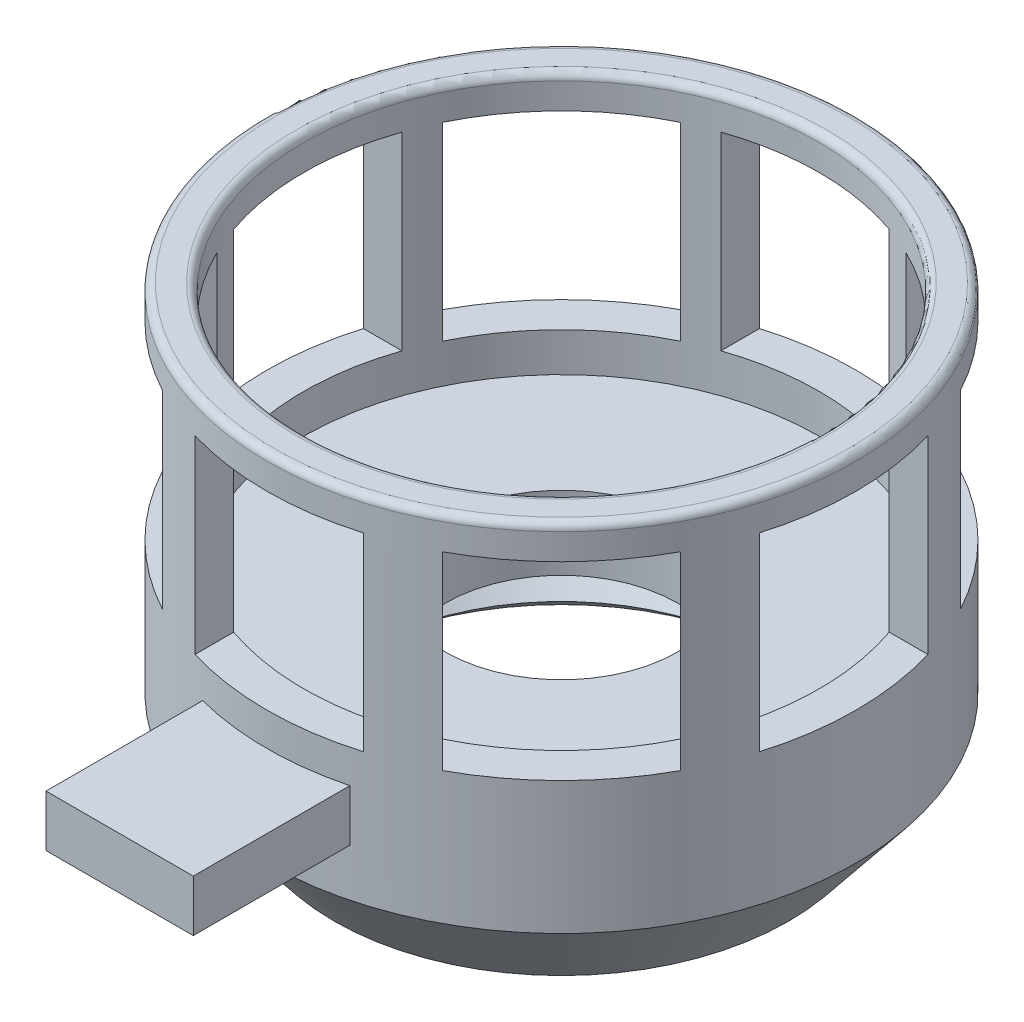
from build123d import *

# Parameters (mm, degrees)
CUT_EXTRUDE_7_REACH              = 96.987
CUT_EXTRUDE_7_END_RADIUS         = 35
SKETCH_9_W                       = 22.863653518
SKETCH_9_H                       = 25.734556693
PATTERN_CIRCULAR_3_COUNT         = 8
SKETCH_11_W                      = 20
SKETCH_11_H                      = 7
EXTRUDE_1_DEPTH                  = 20
EXTRUDE_1_DIRECTION_2_REACH      = 96.987
EXTRUDE_1_DIRECTION_2_END_RADIUS = 40


with BuildPart() as part:
    # 草图1 → 旋转4 (revolve)
    with BuildSketch(Plane.XY, mode=Mode.PRIVATE) as revolve_4_sk:
        with BuildLine():
            Line((-35.764870687, -13.569622936), (-26.953430159, -24.560221363))
            Line((-26.953430159, -24.560221363), (-30.85448893, -27.687798773))
            Line((-30.85448893, -27.687798773), (-40, -16.2805108))
            Line((-40, -16.2805108), (-40, 30.977562367))
            ThreePointArc((-40, 30.977562367), (-39.707106781, 31.684669148), (-39, 31.977562367))
            Line((-39, 31.977562367), (-36, 31.977562367))
            ThreePointArc((-36, 31.977562367), (-35.292893219, 31.684669148), (-35, 30.977562367))
            Line((-35, 30.977562367), (-35, -3.569622936))
            Line((-35, -3.569622936), (-15.764870687, -3.569622936))
            Line((-15.764870687, -3.569622936), (-15.764870687, -13.569622936))
            Line((-15.764870687, -13.569622936), (-35.764870687, -13.569622936))
        make_face()
    revolve(revolve_4_sk.sketch.rotate(Axis((0, 0, 0), (0, 1, 0)), 270), axis=Axis((0, 0, 0), (0, 1, 0)))

    # 切除-拉伸7: up to this cylinder (the profile starts outside it)
    cut_extrude_7_end = Plane(origin=(0, 14.581038, 0), z_dir=(0, -1, 0)) * Cylinder(CUT_EXTRUDE_7_END_RADIUS, 264.974, mode=Mode.PRIVATE)
    # 草图9 → 切除-拉伸7 (cut, up to the surface)
    with BuildSketch(Plane.XY.offset(40), mode=Mode.PRIVATE) as cut_extrude_7_sk1:
        with Locations((0, 14.581037932)):
            Rectangle(SKETCH_9_W, SKETCH_9_H)
    cut_extrude_7_tool1 = extrude(cut_extrude_7_sk1.sketch, amount=-CUT_EXTRUDE_7_REACH, mode=Mode.PRIVATE) - cut_extrude_7_end
    cut_extrude_7 = cut_extrude_7_tool1.solids().sort_by_distance((0, 14.581038, 40))[0]
    add(cut_extrude_7, mode=Mode.SUBTRACT)

    # 阵列(圆周)3: 切除-拉伸7 ×8 about axis
    pattern_circular_3_axis = Axis((0, 0, 0), (0, 1, 0))
    for i in range(1, PATTERN_CIRCULAR_3_COUNT):
        add(cut_extrude_7.rotate(pattern_circular_3_axis, i * 360 / PATTERN_CIRCULAR_3_COUNT), mode=Mode.SUBTRACT)

    # 草图11 → 凸台-拉伸1 (add)
    with BuildSketch(Plane.XY.offset(40)):
        with Locations((0, -6.301485772)):
            Rectangle(SKETCH_11_W, SKETCH_11_H)
    extrude(amount=EXTRUDE_1_DEPTH)

    # 凸台-拉伸1 direction 2: up to this cylinder (the profile starts outside it)
    extrude_1_direction_2_end = Plane(origin=(0, -6.301486, 0), z_dir=(0, -1, 0)) * Cylinder(EXTRUDE_1_DIRECTION_2_END_RADIUS, 274.974, mode=Mode.PRIVATE)
    # 草图11 → 凸台-拉伸1 direction 2 (add, up to the surface)
    with BuildSketch(Plane.XY.offset(40), mode=Mode.PRIVATE) as extrude_1_direction_2_sk1:
        with Locations((0, -6.301485772)):
            Rectangle(SKETCH_11_W, SKETCH_11_H)
    extrude_1_direction_2_tool1 = extrude(extrude_1_direction_2_sk1.sketch, amount=-EXTRUDE_1_DIRECTION_2_REACH, mode=Mode.PRIVATE) - extrude_1_direction_2_end
    add(extrude_1_direction_2_tool1.solids().sort_by_distance((0, -6.301486, 40))[0])
    add(extrude_1_direction_2_tool1.solids().sort_by_distance((0, -6.301486, 40))[1])


solid = part.part
